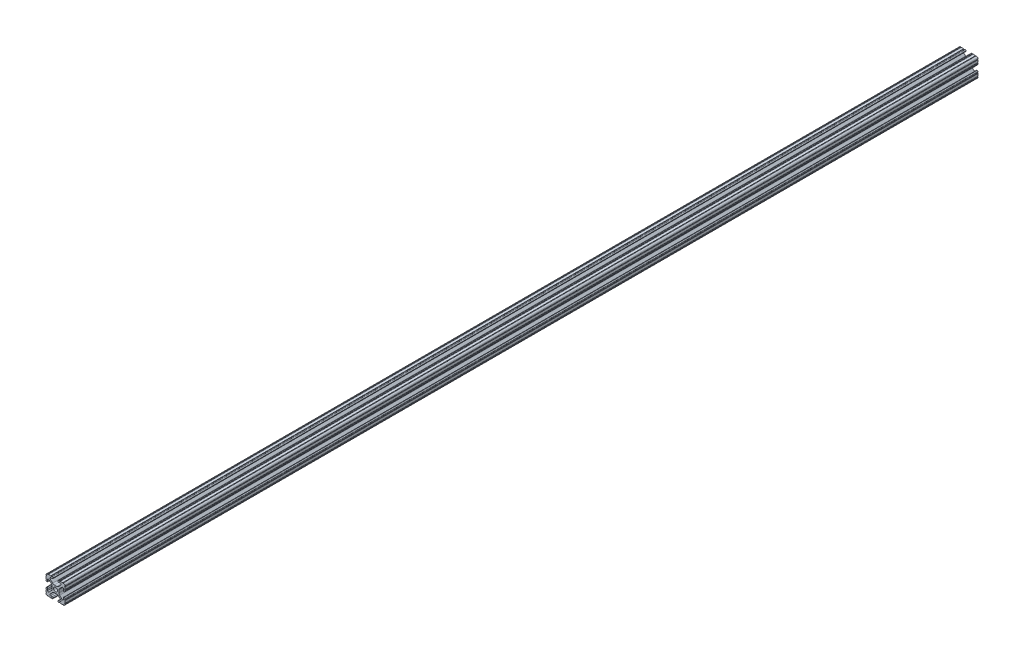
from build123d import *

# Parameters (mm, degrees)
SKETCH1_R           = 2.6035
BOSS_EXTRUDE1_DEPTH = 609.6


with BuildPart() as part:
    # Sketch1 → Boss-Extrude1 (new, symmetric)
    with BuildSketch(Plane.XY):
        with BuildLine():
            Line((-7.179650497, -8.645192506), (-3.952270251, -5.423690499))
            ThreePointArc((-3.952270251, -5.423690499), (-2.922936451, -4.736929036), (-1.709253557, -4.4958))
            Line((-1.709253557, -4.4958), (1.709253557, -4.4958))
            ThreePointArc((1.709253557, -4.4958), (2.922936451, -4.736929036), (3.952270251, -5.423690499))
            Line((3.952270251, -5.423690499), (7.179650497, -8.645192506))
            ThreePointArc((7.179650497, -8.645192506), (7.41473083, -9.822813117), (6.416408329, -10.4902))
            Line((6.416408329, -10.4902), (4.287512407, -10.4902))
            ThreePointArc((4.287512407, -10.4902), (3.54574862, -10.79744862), (3.2385, -11.539212407))
            Line((3.2385, -11.539212407), (3.2385, -11.650987593))
            ThreePointArc((3.2385, -11.650987593), (3.54574862, -12.39275138), (4.287512407, -12.7))
            Line((4.287512407, -12.7), (5.317126718, -12.7))
            ThreePointArc((5.317126718, -12.7), (5.825126718, -12.192), (6.333126718, -12.7))
            Line((6.333126718, -12.7), (9.550443118, -12.7))
            ThreePointArc((9.550443118, -12.7), (10.058366869, -12.192000006), (10.566443095, -12.699847501))
            ThreePointArc((10.566443095, -12.699847501), (12.082537762, -12.08250727), (12.699846982, -10.566399977))
            ThreePointArc((12.699846982, -10.566399977), (12.192000006, -10.058323491), (12.7, -9.5504))
            Line((12.7, -9.5504), (12.7, -6.3330836))
            ThreePointArc((12.7, -6.3330836), (12.192, -5.8250836), (12.7, -5.3170836))
            Line((12.7, -5.3170836), (12.7, -4.287469289))
            ThreePointArc((12.7, -4.287469289), (12.39275138, -3.545705502), (11.650987593, -3.238456882))
            Line((11.650987593, -3.238456882), (11.539212407, -3.238456882))
            ThreePointArc((11.539212407, -3.238456882), (10.79744862, -3.545705502), (10.4902, -4.287469289))
            Line((10.4902, -4.287469289), (10.4902, -6.402089023))
            ThreePointArc((10.4902, -6.402089023), (9.856505071, -7.351067942), (8.737131347, -7.129408934))
            Line((8.737131347, -7.129408934), (5.441005833, -3.840816462))
            ThreePointArc((5.441005833, -3.840816462), (4.750877967, -2.809883091), (4.5085, -1.593185507))
            Line((4.5085, -1.593185507), (4.5085, 1.593185507))
            ThreePointArc((4.5085, 1.593185507), (4.750877967, 2.809883091), (5.441005833, 3.840816462))
            Line((5.441005833, 3.840816462), (8.737131347, 7.129408934))
            ThreePointArc((8.737131347, 7.129408934), (9.856505071, 7.351067942), (10.4902, 6.402089023))
            Line((10.4902, 6.402089023), (10.4902, 4.287469289))
            ThreePointArc((10.4902, 4.287469289), (10.79744862, 3.545705502), (11.539212407, 3.238456882))
            Line((11.539212407, 3.238456882), (11.650987593, 3.238456882))
            ThreePointArc((11.650987593, 3.238456882), (12.39275138, 3.545705502), (12.7, 4.287469289))
            Line((12.7, 4.287469289), (12.7, 5.3170836))
            ThreePointArc((12.7, 5.3170836), (12.192, 5.8250836), (12.7, 6.3330836))
            Line((12.7, 6.3330836), (12.7, 9.5504))
            ThreePointArc((12.7, 9.5504), (12.192000006, 10.058323491), (12.699846982, 10.566399977))
            ThreePointArc((12.699846982, 10.566399977), (12.082537762, 12.08250727), (10.566443095, 12.699847501))
            ThreePointArc((10.566443095, 12.699847501), (10.058366869, 12.192000006), (9.550443118, 12.7))
            Line((9.550443118, 12.7), (6.333126718, 12.7))
            ThreePointArc((6.333126718, 12.7), (5.825126718, 12.192), (5.317126718, 12.7))
            Line((5.317126718, 12.7), (4.287512407, 12.7))
            ThreePointArc((4.287512407, 12.7), (3.54574862, 12.39275138), (3.2385, 11.650987593))
            Line((3.2385, 11.650987593), (3.2385, 11.539212407))
            ThreePointArc((3.2385, 11.539212407), (3.54574862, 10.79744862), (4.287512407, 10.4902))
            Line((4.287512407, 10.4902), (6.476788598, 10.4902))
            ThreePointArc((6.476788598, 10.4902), (7.432222385, 9.85140422), (7.207036008, 8.724370562))
            Line((7.207036008, 8.724370562), (3.898272566, 5.423169045))
            ThreePointArc((3.898272566, 5.423169045), (2.869120213, 4.736787962), (1.655778399, 4.4958))
            Line((1.655778399, 4.4958), (-1.655778399, 4.4958))
            ThreePointArc((-1.655778399, 4.4958), (-2.869120213, 4.736787962), (-3.898272566, 5.423169045))
            Line((-3.898272566, 5.423169045), (-7.207036008, 8.724370562))
            ThreePointArc((-7.207036008, 8.724370562), (-7.432222385, 9.85140422), (-6.476788598, 10.4902))
            Line((-6.476788598, 10.4902), (-4.287512407, 10.4902))
            ThreePointArc((-4.287512407, 10.4902), (-3.54574862, 10.79744862), (-3.2385, 11.539212407))
            Line((-3.2385, 11.539212407), (-3.2385, 11.650987593))
            ThreePointArc((-3.2385, 11.650987593), (-3.54574862, 12.39275138), (-4.287512407, 12.7))
            Line((-4.287512407, 12.7), (-5.317126718, 12.7))
            ThreePointArc((-5.317126718, 12.7), (-5.825126718, 12.192), (-6.333126718, 12.7))
            Line((-6.333126718, 12.7), (-9.550443118, 12.7))
            ThreePointArc((-9.550443118, 12.7), (-10.058366869, 12.192000006), (-10.566443095, 12.699847501))
            ThreePointArc((-10.566443095, 12.699847501), (-12.082537762, 12.08250727), (-12.699846982, 10.566399977))
            ThreePointArc((-12.699846982, 10.566399977), (-12.192000006, 10.058323491), (-12.7, 9.5504))
            Line((-12.7, 9.5504), (-12.7, 6.3330836))
            ThreePointArc((-12.7, 6.3330836), (-12.192, 5.8250836), (-12.7, 5.3170836))
            Line((-12.7, 5.3170836), (-12.7, 4.287469289))
            ThreePointArc((-12.7, 4.287469289), (-12.39275138, 3.545705502), (-11.650987593, 3.238456882))
            Line((-11.650987593, 3.238456882), (-11.539212407, 3.238456882))
            ThreePointArc((-11.539212407, 3.238456882), (-10.79744862, 3.545705502), (-10.4902, 4.287469289))
            Line((-10.4902, 4.287469289), (-10.4902, 6.402089023))
            ThreePointArc((-10.4902, 6.402089023), (-9.856505071, 7.351067942), (-8.737131347, 7.129408934))
            Line((-8.737131347, 7.129408934), (-5.441005833, 3.840816462))
            ThreePointArc((-5.441005833, 3.840816462), (-4.750877967, 2.809883091), (-4.5085, 1.593185507))
            Line((-4.5085, 1.593185507), (-4.5085, -1.593185507))
            ThreePointArc((-4.5085, -1.593185507), (-4.750877967, -2.809883091), (-5.441005833, -3.840816462))
            Line((-5.441005833, -3.840816462), (-8.737131347, -7.129408934))
            ThreePointArc((-8.737131347, -7.129408934), (-9.856505071, -7.351067942), (-10.4902, -6.402089023))
            Line((-10.4902, -6.402089023), (-10.4902, -4.287469289))
            ThreePointArc((-10.4902, -4.287469289), (-10.79744862, -3.545705502), (-11.539212407, -3.238456882))
            Line((-11.539212407, -3.238456882), (-11.650987593, -3.238456882))
            ThreePointArc((-11.650987593, -3.238456882), (-12.39275138, -3.545705502), (-12.7, -4.287469289))
            Line((-12.7, -4.287469289), (-12.7, -5.3170836))
            ThreePointArc((-12.7, -5.3170836), (-12.192, -5.8250836), (-12.7, -6.3330836))
            Line((-12.7, -6.3330836), (-12.7, -9.5504))
            ThreePointArc((-12.7, -9.5504), (-12.192000006, -10.058323491), (-12.699846982, -10.566399977))
            ThreePointArc((-12.699846982, -10.566399977), (-12.082537762, -12.08250727), (-10.566443095, -12.699847501))
            ThreePointArc((-10.566443095, -12.699847501), (-10.058366869, -12.192000006), (-9.550443118, -12.7))
            Line((-9.550443118, -12.7), (-6.333126718, -12.7))
            ThreePointArc((-6.333126718, -12.7), (-5.825126718, -12.192), (-5.317126718, -12.7))
            Line((-5.317126718, -12.7), (-4.287512407, -12.7))
            ThreePointArc((-4.287512407, -12.7), (-3.54574862, -12.39275138), (-3.2385, -11.650987593))
            Line((-3.2385, -11.650987593), (-3.2385, -11.539212407))
            ThreePointArc((-3.2385, -11.539212407), (-3.54574862, -10.79744862), (-4.287512407, -10.4902))
            Line((-4.287512407, -10.4902), (-6.416408329, -10.4902))
            ThreePointArc((-6.416408329, -10.4902), (-7.41473083, -9.822813117), (-7.179650497, -8.645192506))
        make_face()
        with Locations(Location((0, 0, 0), (0, 0, 180))):
            Circle(SKETCH1_R, mode=Mode.SUBTRACT)
    extrude(amount=BOSS_EXTRUDE1_DEPTH, both=True)


solid = part.part
